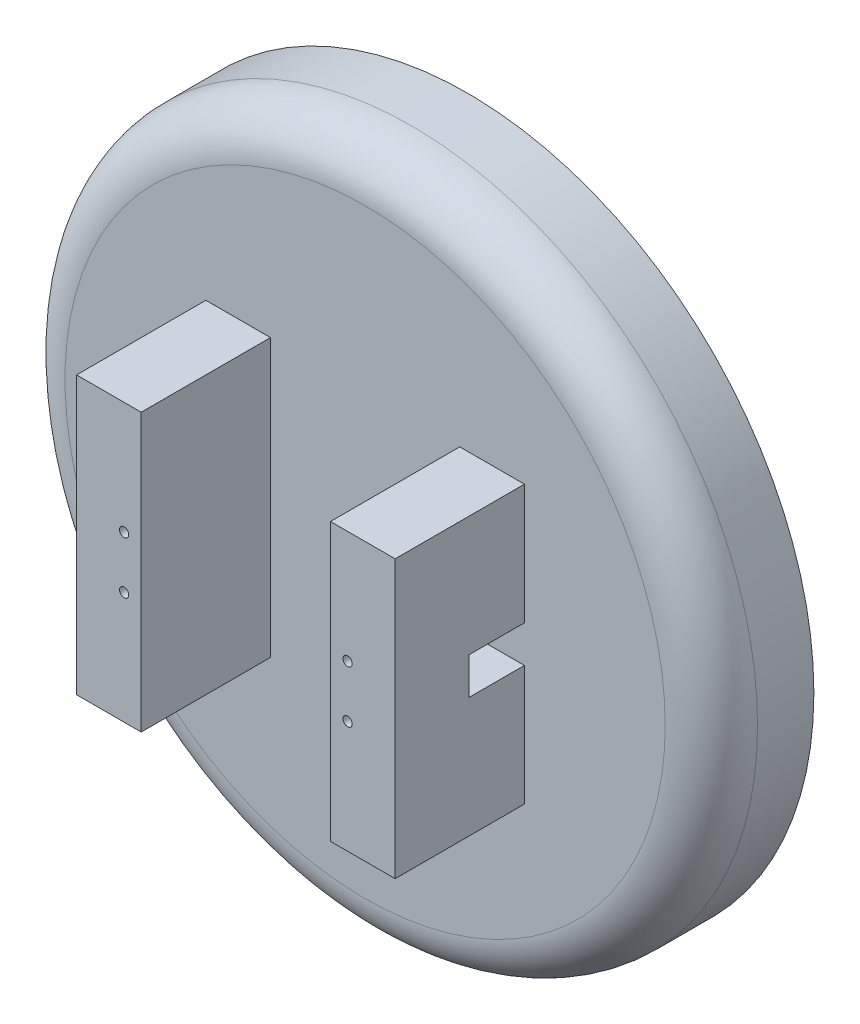
from build123d import *

# Parameters (mm, degrees)
ESQUISSE1_R               = 75
BOSS_EXTRU_1_DEPTH        = 22.2
CONG_1_R                  = 10
ESQUISSE2_W               = 14
ESQUISSE2_H               = 60
BOSS_EXTRU_2_DEPTH        = 28
ESQUISSE3_R               = 1
ENL_V_MAT_EXTRU_1_DEPTH   = 10
ESQUISSE5_W               = 12
ESQUISSE5_H               = 8
PASSAGE_CABLE_MG995_DEPTH = 118.34581373


with BuildPart() as part:
    # Esquisse1 → Boss.-Extru.1 (new body)
    with BuildSketch(Plane.XY):
        Circle(ESQUISSE1_R)
    extrude(amount=BOSS_EXTRU_1_DEPTH)

    # Congé1
    cong_1_edges = [part.edges().sort_by_distance(p)[0] for p in [
        (-75, 0, 22.2),
    ]]
    fillet(cong_1_edges, radius=CONG_1_R)

    # Esquisse2 → Boss.-Extru.2 (add)
    with BuildSketch(Plane.XY.offset(22.2)):
        with Locations((-27.5, 0)):
            Rectangle(ESQUISSE2_W, ESQUISSE2_H)
        with Locations((27.5, 0)):
            Rectangle(ESQUISSE2_W, ESQUISSE2_H)
    extrude(amount=BOSS_EXTRU_2_DEPTH)

    # Esquisse3 → Enlèv. mat.-Extru.1 (cut)
    with BuildSketch(Plane.XY.offset(50.2)):
        with Locations((-24.2, 5.65)):
            Circle(ESQUISSE3_R)
        with Locations(Location((-24.2, -5.65, 0), (0, 0, 180))):
            Circle(ESQUISSE3_R)
        with Locations((24.2, -5.65)):
            Circle(ESQUISSE3_R)
        with Locations(Location((24.2, 5.65, 0), (0, 0, 180))):
            Circle(ESQUISSE3_R)
    extrude(amount=-ENL_V_MAT_EXTRU_1_DEPTH, mode=Mode.SUBTRACT)

    # Esquisse5 → Passage cable MG995 (cut, through all)
    with BuildSketch(Plane(origin=(0, 0, 0), x_dir=(0, 0, -1), z_dir=(1, 0, 0))):
        with Locations((-28.2, 0)):
            Rectangle(ESQUISSE5_W, ESQUISSE5_H)
    extrude(amount=PASSAGE_CABLE_MG995_DEPTH, mode=Mode.SUBTRACT)


solid = part.part
